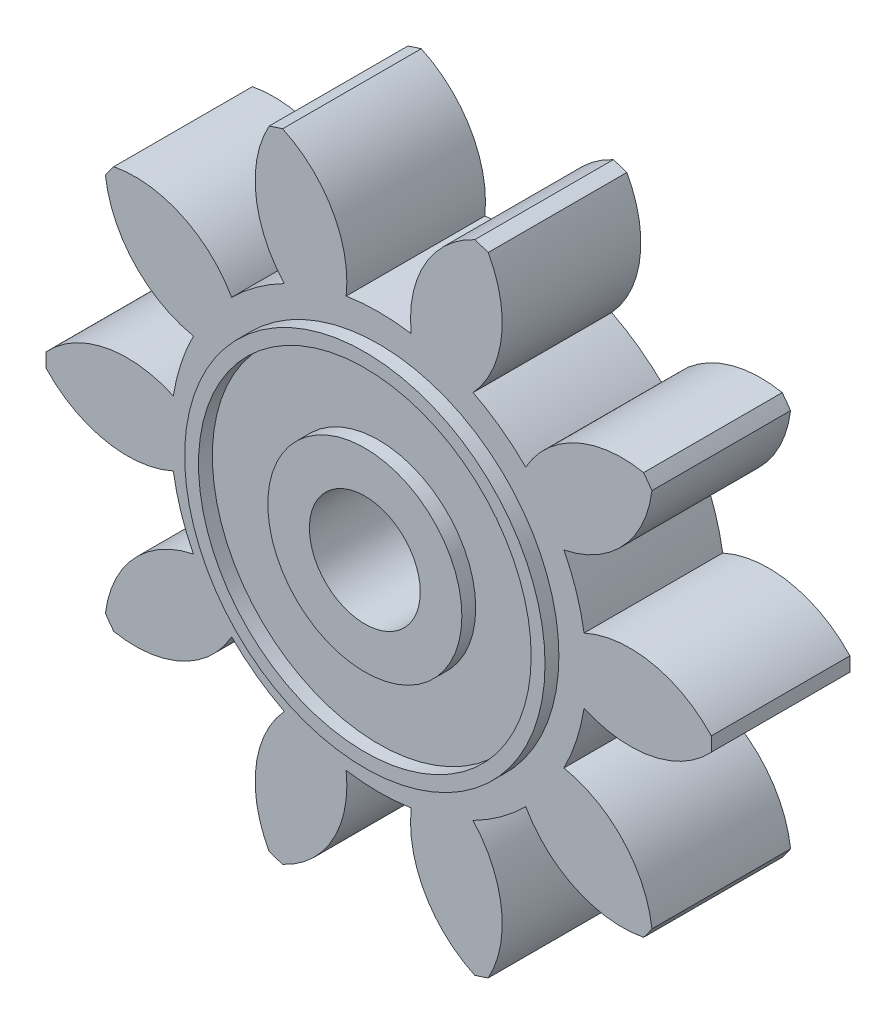
from build123d import *

# Parameters (mm, degrees)
SKETCH1_R           = 12
BOSS_EXTRUDE1_DEPTH = 2.5
CUT_EXTRUDE2_DEPTH  = 18.691806013
CIRPATTERN2_COUNT   = 10
SKETCH3_R           = 2
CUT_EXTRUDE3_DEPTH  = 18.349304428
BOSS_EXTRUDE2_START = 0.5
SKETCH4_R           = 6.5
SKETCH4_R_2         = 6
SKETCH4_R_3         = 3.5
SKETCH4_R_4         = 2
BOSS_EXTRUDE2_DEPTH = 0.5


with BuildPart() as part:
    # Sketch1 → Boss-Extrude1 (new, symmetric)
    with BuildSketch(Plane.XY):
        Circle(SKETCH1_R)
    extrude(amount=BOSS_EXTRUDE1_DEPTH, both=True)

    # Sketch2 → Cut-Extrude2 (cut, through all)
    with BuildSketch(Plane.XY.offset(2.5)):
        with BuildLine():
            ThreePointArc((1.173656282, 7.407599539), (0, 7.5), (-1.173656282, 7.407599539))
            ThreePointArc((-1.173656282, 7.407599539), (-1.669021324, 9.83476625), (-3.49865822, 11.504782295))
            ThreePointArc((-3.49865822, 11.504782295), (0, 12.025), (3.49865822, 11.504782295))
            ThreePointArc((3.49865822, 11.504782295), (1.669021324, 9.83476625), (1.173656282, 7.407599539))
        make_face()
    cut_extrude2 = extrude(amount=-CUT_EXTRUDE2_DEPTH, mode=Mode.SUBTRACT)

    # CirPattern2: Cut-Extrude2 ×10 about axis
    cirpattern2_axis = Axis((0, 0, 0), (0, 0, 1))
    for i in range(1, CIRPATTERN2_COUNT):
        add(cut_extrude2.rotate(cirpattern2_axis, i * 360 / CIRPATTERN2_COUNT), mode=Mode.SUBTRACT)

    # Sketch3 → Cut-Extrude3 (cut, through all)
    with BuildSketch(Plane.XY.offset(2.5)):
        Circle(SKETCH3_R)
    extrude(amount=-CUT_EXTRUDE3_DEPTH, mode=Mode.SUBTRACT)

    # Sketch4 → Boss-Extrude2 (add)
    # profile 1 of 2: a face of its own
    with BuildSketch(Plane.XY.offset(2.5).offset(BOSS_EXTRUDE2_START)):
        Circle(SKETCH4_R)
        Circle(SKETCH4_R_2, mode=Mode.SUBTRACT)
    # profile 2 of 2: a face of its own
    with BuildSketch(Plane.XY.offset(2.5).offset(BOSS_EXTRUDE2_START)):
        Circle(SKETCH4_R_3)
        Circle(SKETCH4_R_4, mode=Mode.SUBTRACT)
    boss_extrude2 = extrude(amount=-BOSS_EXTRUDE2_DEPTH)

    # Mirror1: Boss-Extrude2 across plane
    add(boss_extrude2.mirror(Plane.XY))


solid = part.part
